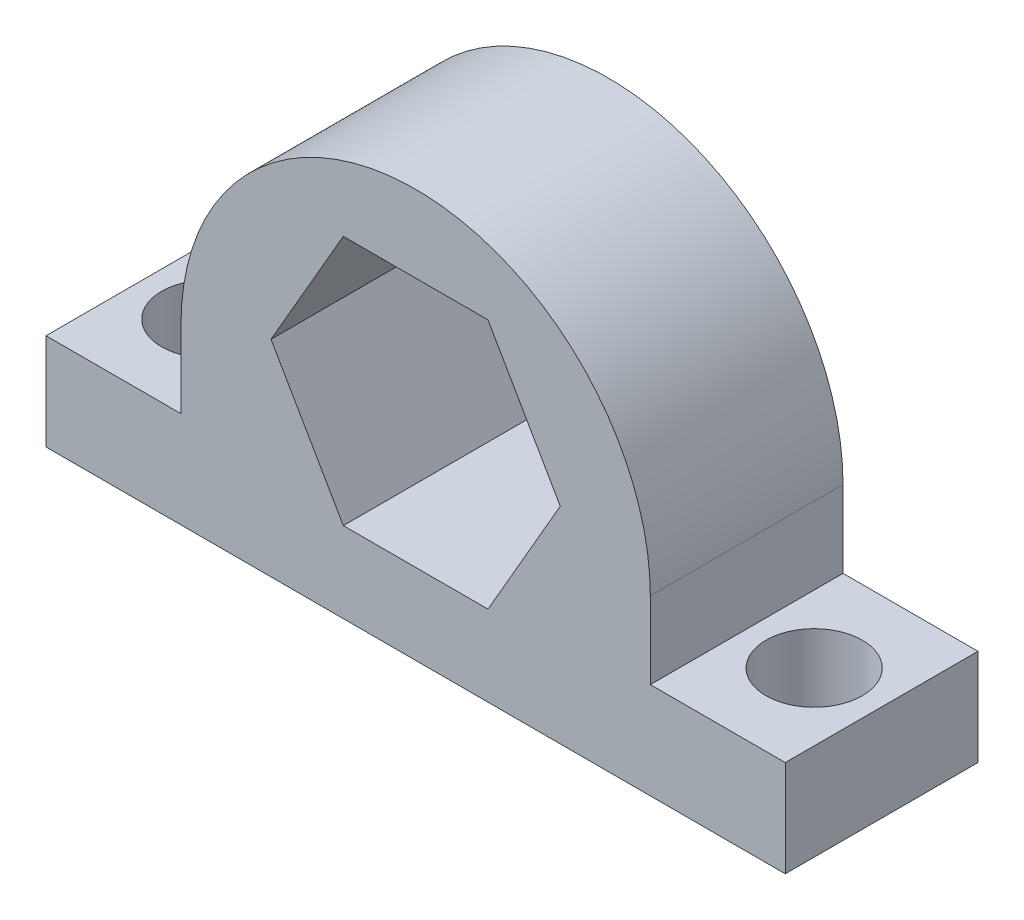
from build123d import *

# Parameters (mm, degrees)
BOSS_EXTRUDE1_DEPTH = 10
SKETCH2_R           = 2.5
CUT_EXTRUDE1_DEPTH  = 10


with BuildPart() as part:
    # Sketch1 → Boss-Extrude1 (new body)
    with BuildSketch(Plane.XY):
        with BuildLine():
            Line((-16, 0), (16, 0))
            Line((16, 0), (19.18, 0))
            Line((19.18, 0), (19.18, 5))
            Line((19.18, 5), (16, 5))
            Line((16, 5), (12.17699115, 5))
            Line((12.17699115, 5), (12.17699115, 8.995638399))
            ThreePointArc((12.17699115, 8.995638399), (0, 21.172629549), (-12.17699115, 8.995638399))
            Line((-12.17699115, 8.995638399), (-12.17699115, 5))
            Line((-12.17699115, 5), (-16, 5))
            Line((-16, 5), (-19.18, 5))
            Line((-19.18, 5), (-19.18, 0))
            Line((-19.18, 0), (-16, 0))
        make_face()
        Polygon((7.504424779, 10.68), (3.752212389, 17.179022499), (-3.752212389, 17.179022499), (-7.504424779, 10.68), (-3.752212389, 4.180977501), (3.752212389, 4.180977501), align=None, mode=Mode.SUBTRACT)
    extrude(amount=BOSS_EXTRUDE1_DEPTH)

    # Sketch2 → Cut-Extrude1 (cut)
    with BuildSketch(Plane(origin=(0, 5, 0), x_dir=(1, 0, 0), z_dir=(0, 1, 0))):
        with Locations(Location((15.678495575, -5, 0), (0, 0, 270))):
            Circle(SKETCH2_R)
        with Locations(Location((-15.678495575, -5, 0), (0, 0, 270))):
            Circle(SKETCH2_R)
    extrude(amount=-CUT_EXTRUDE1_DEPTH, mode=Mode.SUBTRACT)


solid = part.part
